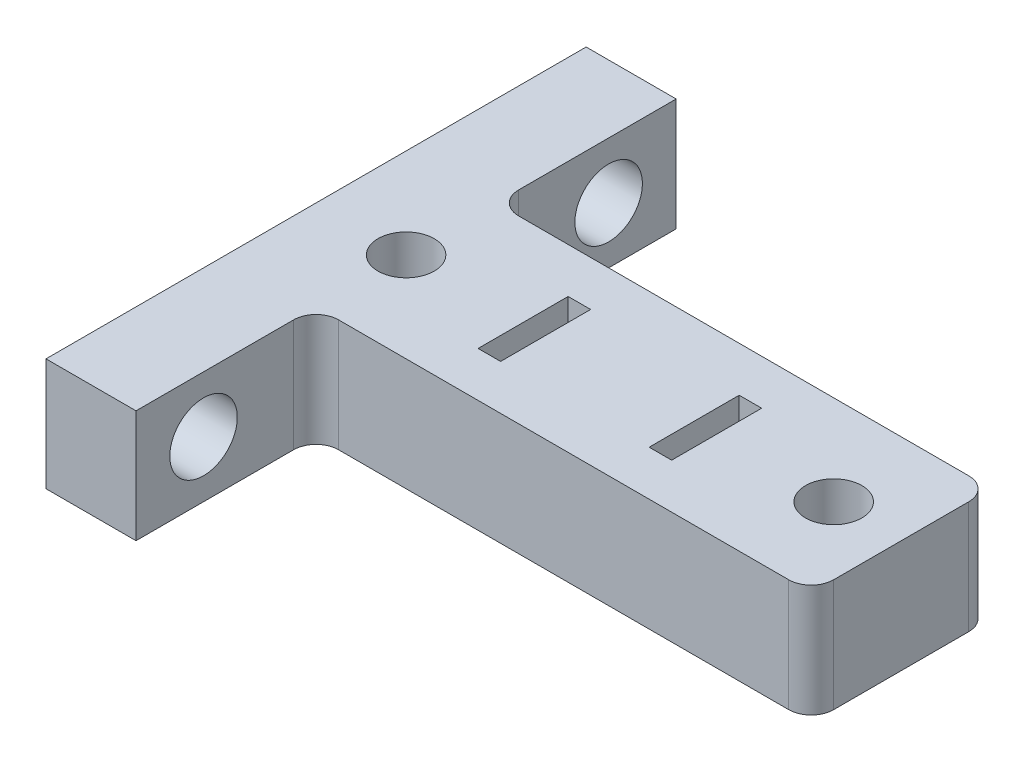
from build123d import *

# Parameters (mm, degrees)
SKETCH1_R           = 1.25
SKETCH1_W           = 1
SKETCH1_H           = 4
BOSS_EXTRUDE1_DEPTH = 5
SKETCH3_R           = 1.5
CUT_EXTRUDE1_DEPTH  = 4


with BuildPart() as part:
    # Sketch1 → Boss-Extrude1 (new body)
    with BuildSketch(Plane(origin=(0, 0, 0), x_dir=(1, 0, 0), z_dir=(0, 1, 0))):
        with BuildLine():
            Line((-13, -3), (-13, -12))
            Line((-13, -12), (-9, -12))
            Line((-9, -12), (-9, -5))
            ThreePointArc((-9, -5), (-8.707106781, -4.292893219), (-8, -4))
            Line((-8, -4), (12, -4))
            ThreePointArc((12, -4), (12.707106781, -3.707106781), (13, -3))
            Line((13, -3), (13, 3))
            ThreePointArc((13, 3), (12.707106781, 3.707106781), (12, 4))
            Line((12, 4), (-8, 4))
            ThreePointArc((-8, 4), (-8.707106781, 4.292893219), (-9, 5))
            Line((-9, 5), (-9, 12))
            Line((-9, 12), (-13, 12))
            Line((-13, 12), (-13, 4))
            Line((-13, 4), (-13, -3))
        make_face()
        with Locations(Location((10, 0, 0), (0, 0, 270))):
            Circle(SKETCH1_R, mode=Mode.SUBTRACT)
        with Locations(Location((-9, 0, 0), (0, 0, 270))):
            Circle(SKETCH1_R, mode=Mode.SUBTRACT)
        with Locations((4.3, 0)):
            Rectangle(SKETCH1_W, SKETCH1_H, mode=Mode.SUBTRACT)
        with Locations((-3.3, 0)):
            Rectangle(SKETCH1_W, SKETCH1_H, mode=Mode.SUBTRACT)
    extrude(amount=BOSS_EXTRUDE1_DEPTH)

    # Sketch3 → Cut-Extrude1 (cut)
    with BuildSketch(Plane.ZY.offset(13)):
        with Locations((9, 2.5)):
            Circle(SKETCH3_R)
        with Locations((-9, 2.5)):
            Circle(SKETCH3_R)
    extrude(amount=-CUT_EXTRUDE1_DEPTH, mode=Mode.SUBTRACT)


solid = part.part
